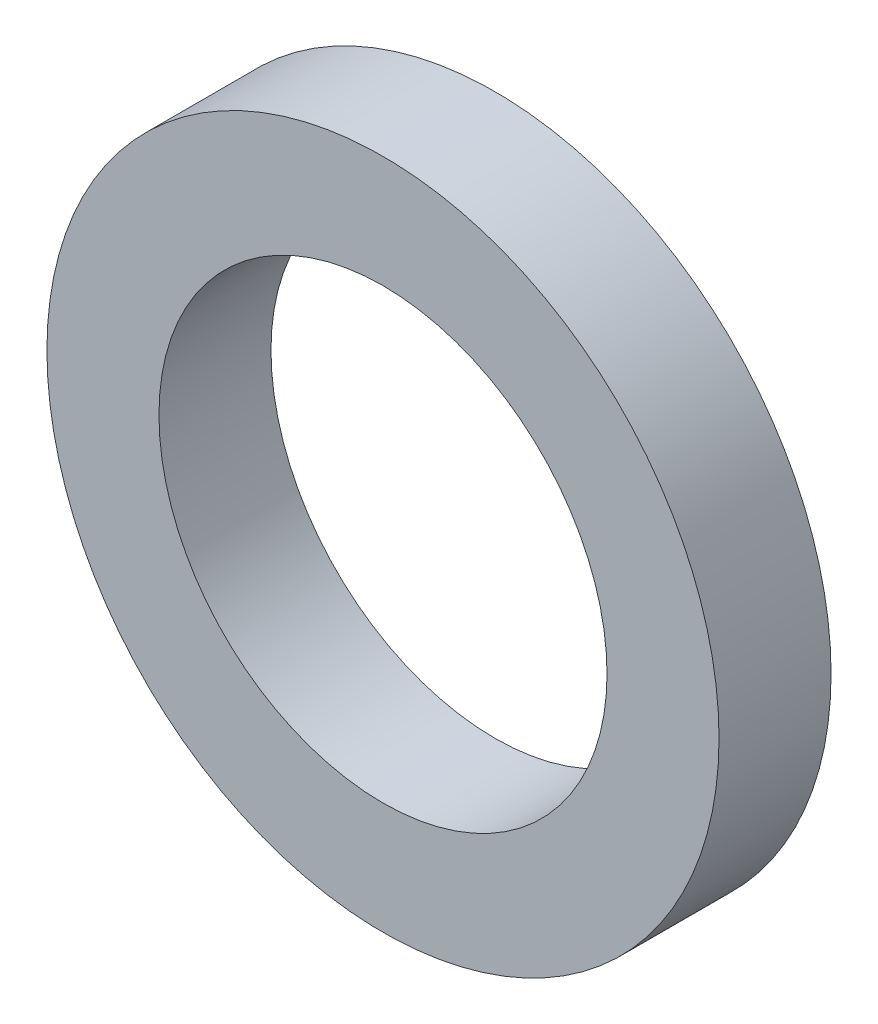
from build123d import *

# Parameters (mm, degrees)
SKETCH1_R           = 19.05
SKETCH1_R_2         = 12.7
BOSS_EXTRUDE1_DEPTH = 6.35


with BuildPart() as part:
    # Sketch1 → Boss-Extrude1 (new body)
    with BuildSketch(Plane.XY):
        Circle(SKETCH1_R)
        Circle(SKETCH1_R_2, mode=Mode.SUBTRACT)
    extrude(amount=BOSS_EXTRUDE1_DEPTH)


solid = part.part
